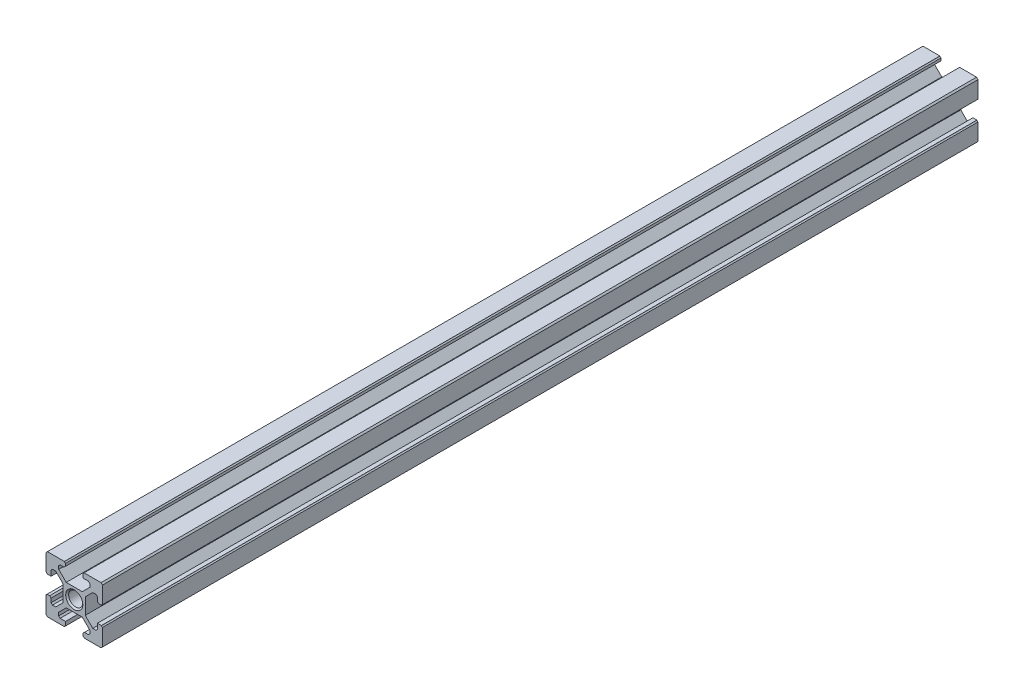
from build123d import *

# Parameters (mm, degrees)
BOSS_EXTRUDE1_DEPTH             = 310
M6X1_0_TAPPED_HOLE2_D           = 5
M6X1_0_TAPPED_HOLE2_DEPTH       = 28.497848452
M6X1_0_TAPPED_HOLE2_CSINK_D     = 6.05
M6X1_0_TAPPED_HOLE2_CSINK_ANGLE = 90
M6X1_0_TAPPED_HOLE2_TIP         = 1.502151548


with BuildPart() as part:
    # Sketch1 → Boss-Extrude1 (new body)
    with BuildSketch(Plane.XY):
        with BuildLine():
            Line((-9.5, 10), (-3.486470896, 10))
            ThreePointArc((-3.486470896, 10), (-3.373276191, 9.726723809), (-3.1, 9.613529104))
            Line((-3.1, 9.613529104), (-3.1, 8.7))
            Line((-3.1, 8.7), (-3.6, 8.2))
            Line((-3.6, 8.2), (-5, 8.2))
            Line((-5, 8.2), (-5.5, 7.7))
            Line((-5.5, 7.7), (-5.5, 6.560660172))
            Line((-5.5, 6.560660172), (-2.839339828, 3.9))
            Line((-2.839339828, 3.9), (0, 3.9))
            Line((0, 3.9), (2.839339828, 3.9))
            Line((2.839339828, 3.9), (5.5, 6.560660172))
            Line((5.5, 6.560660172), (5.5, 7.7))
            Line((5.5, 7.7), (5, 8.2))
            Line((5, 8.2), (3.1, 8.2))
            Line((3.1, 8.2), (3.1, 9.613529104))
            ThreePointArc((3.1, 9.613529104), (3.373276191, 9.726723809), (3.486470896, 10))
            Line((3.486470896, 10), (9.5, 10))
            Line((9.5, 10), (10, 9.5))
            Line((10, 9.5), (10, 3.486470896))
            ThreePointArc((10, 3.486470896), (9.726723809, 3.373276191), (9.613529104, 3.1))
            Line((9.613529104, 3.1), (8.7, 3.1))
            Line((8.7, 3.1), (8.2, 3.6))
            Line((8.2, 3.6), (8.2, 5))
            Line((8.2, 5), (7.7, 5.5))
            Line((7.7, 5.5), (6.560660172, 5.5))
            Line((6.560660172, 5.5), (3.9, 2.839339828))
            Line((3.9, 2.839339828), (3.9, 0))
            Line((3.9, 0), (3.9, -2.839339828))
            Line((3.9, -2.839339828), (6.560660172, -5.5))
            Line((6.560660172, -5.5), (7.7, -5.5))
            Line((7.7, -5.5), (8.2, -5))
            Line((8.2, -5), (8.2, -3.1))
            Line((8.2, -3.1), (9.613529104, -3.1))
            ThreePointArc((9.613529104, -3.1), (9.726723809, -3.373276191), (10, -3.486470896))
            Line((10, -3.486470896), (10, -9.5))
            Line((10, -9.5), (9.5, -10))
            Line((9.5, -10), (3.486470896, -10))
            ThreePointArc((3.486470896, -10), (3.373276191, -9.726723809), (3.1, -9.613529104))
            Line((3.1, -9.613529104), (3.1, -8.7))
            Line((3.1, -8.7), (3.6, -8.2))
            Line((3.6, -8.2), (5, -8.2))
            Line((5, -8.2), (5.5, -7.7))
            Line((5.5, -7.7), (5.5, -6.560660172))
            Line((5.5, -6.560660172), (2.839339828, -3.9))
            Line((2.839339828, -3.9), (0, -3.9))
            Line((0, -3.9), (-2.839339828, -3.9))
            Line((-2.839339828, -3.9), (-5.5, -6.560660172))
            Line((-5.5, -6.560660172), (-5.5, -7.7))
            Line((-5.5, -7.7), (-5, -8.2))
            Line((-5, -8.2), (-3.1, -8.2))
            Line((-3.1, -8.2), (-3.1, -9.613529104))
            ThreePointArc((-3.1, -9.613529104), (-3.373276191, -9.726723809), (-3.486470896, -10))
            Line((-3.486470896, -10), (-9.5, -10))
            Line((-9.5, -10), (-10, -9.5))
            Line((-10, -9.5), (-10, -3.486470896))
            ThreePointArc((-10, -3.486470896), (-9.726723809, -3.373276191), (-9.613529104, -3.1))
            Line((-9.613529104, -3.1), (-8.7, -3.1))
            Line((-8.7, -3.1), (-8.2, -3.6))
            Line((-8.2, -3.6), (-8.2, -5))
            Line((-8.2, -5), (-7.7, -5.5))
            Line((-7.7, -5.5), (-6.560660172, -5.5))
            Line((-6.560660172, -5.5), (-3.9, -2.839339828))
            Line((-3.9, -2.839339828), (-3.9, 0))
            Line((-3.9, 0), (-3.9, 2.839339828))
            Line((-3.9, 2.839339828), (-6.560660172, 5.5))
            Line((-6.560660172, 5.5), (-7.7, 5.5))
            Line((-7.7, 5.5), (-8.2, 5))
            Line((-8.2, 5), (-8.2, 3.1))
            Line((-8.2, 3.1), (-9.613529104, 3.1))
            ThreePointArc((-9.613529104, 3.1), (-9.726723809, 3.373276191), (-10, 3.486470896))
            Line((-10, 3.486470896), (-10, 9.5))
            Line((-10, 9.5), (-9.5, 10))
        make_face()
    extrude(amount=BOSS_EXTRUDE1_DEPTH)

    # Sketch2 → M6x1.0 Tapped Hole1 (revolve, cut)
    with BuildSketch(Plane(origin=(0, 0, 310), x_dir=(0, -1, 0), z_dir=(1, 0, 0))):
        Polygon((0, 0), (0, 30), (2.5, 28.497848452), (2.5, 0.525), (3.025, 0), align=None)
    revolve(axis=Axis((0, 0, 316.35), (0, 0, -1)), mode=Mode.SUBTRACT)

    # M6x1.0 Tapped Hole2
    with Locations(Plane(origin=(0, 0, 0), x_dir=(-1, 0, 0), z_dir=(0, 0, -1))):
        with Locations((0, 0)):
            CounterSinkHole(M6X1_0_TAPPED_HOLE2_D / 2, M6X1_0_TAPPED_HOLE2_CSINK_D / 2, depth=M6X1_0_TAPPED_HOLE2_DEPTH, counter_sink_angle=M6X1_0_TAPPED_HOLE2_CSINK_ANGLE)
            with Locations((0, 0, -(M6X1_0_TAPPED_HOLE2_DEPTH + M6X1_0_TAPPED_HOLE2_TIP / 2))):  # 118° drill point
                Cone(0, M6X1_0_TAPPED_HOLE2_D / 2, M6X1_0_TAPPED_HOLE2_TIP, mode=Mode.SUBTRACT)


solid = part.part
